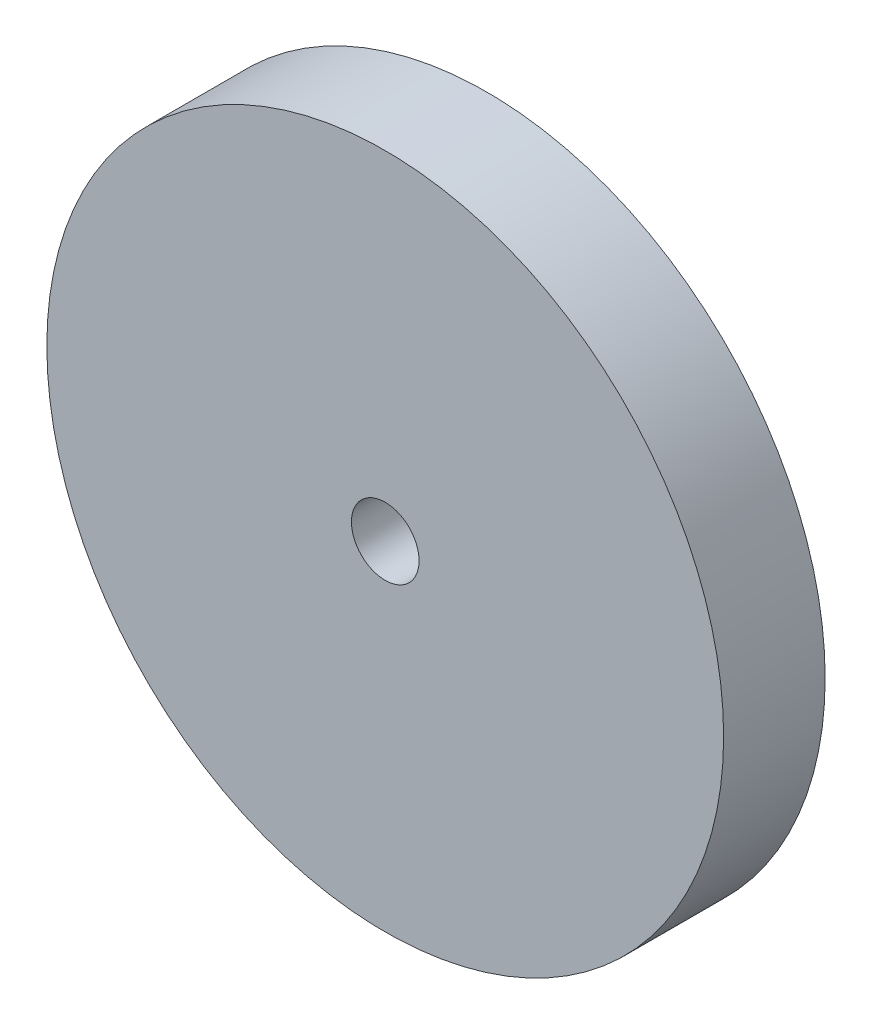
from build123d import *

# Parameters (mm, degrees)
SKETCH1_R           = 100
SKETCH1_R_2         = 10
BOSS_EXTRUDE1_DEPTH = 30


with BuildPart() as part:
    # Sketch1 → Boss-Extrude1 (new body)
    with BuildSketch(Plane.XY):
        Circle(SKETCH1_R)
        Circle(SKETCH1_R_2, mode=Mode.SUBTRACT)
    extrude(amount=BOSS_EXTRUDE1_DEPTH)


solid = part.part
